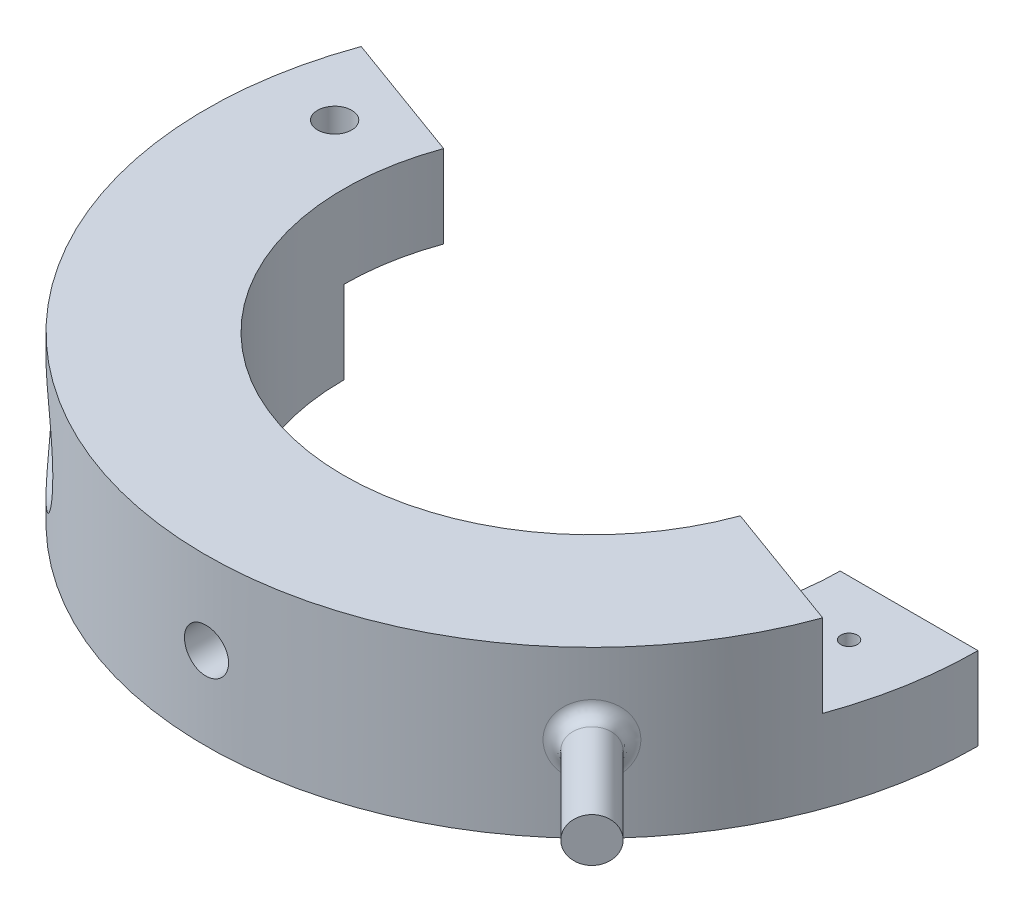
from build123d import *

# Parameters (mm, degrees)
BOSS_EXTRUDE1_DEPTH      = 30
BOSS_EXTRUDE2_START      = -15
BOSS_EXTRUDE2_DEPTH      = 15
CUT_EXTRUDE1_START       = -15
CUT_EXTRUDE1_DEPTH       = 15
SKETCH5_R                = 1.5
CUT_EXTRUDE2_DEPTH       = 15
SKETCH6_R                = 3.1
CUT_EXTRUDE4_DEPTH       = 5
SKETCH7_R                = 1.5
CUT_EXTRUDE5_DEPTH       = 15
SKETCH10_R               = 3.1
CUT_EXTRUDE6_DEPTH       = 5
SKETCH11_R               = 4
CUT_EXTRUDE8_DEPTH       = 30
BOSS_EXTRUDE3_DEPTH      = 22
BOSS_EXTRUDE3_DEPTH_BACK = 10
SKETCH13_R               = 4
SKETCH15_R               = 7.5
CUT_EXTRUDE9_DEPTH       = 30
SKETCH16_R               = 11
CUT_EXTRUDE10_DEPTH      = 20
FILLET2_R                = 2.5


with BuildPart() as part:
    # Sketch2 → Boss-Extrude1 (new body)
    with BuildSketch(Plane(origin=(0, 0, 0), x_dir=(1, 0, 0), z_dir=(0, 1, 0))):
        with BuildLine():
            Line((-70, 0), (-45, 0))
            ThreePointArc((-45, 0), (0, -45), (45, 0))
            Line((45, 0), (70, 0))
            ThreePointArc((70, 0), (0, -70), (-70, 0))
        make_face()
    extrude(amount=BOSS_EXTRUDE1_DEPTH)

    # Sketch3 → Boss-Extrude2 (add)
    with BuildSketch(Plane(origin=(0, 30, 0), x_dir=(1, 0, 0), z_dir=(0, 1, 0)).offset(BOSS_EXTRUDE2_START)):
        with BuildLine():
            Line((-65.778483455, 23.941410033), (-42.286167935, 15.39090645))
            ThreePointArc((-42.286167935, 15.39090645), (-44.316348886, 7.814167995), (-45, 0))
            Line((-45, 0), (-70, 0))
            ThreePointArc((-70, 0), (-68.936542711, 12.155372437), (-65.778483455, 23.941410033))
        make_face()
    extrude(amount=BOSS_EXTRUDE2_DEPTH)

    # Sketch4 → Cut-Extrude1 (cut)
    with BuildSketch(Plane(origin=(0, 30, 0), x_dir=(1, 0, 0), z_dir=(0, 1, 0)).offset(CUT_EXTRUDE1_START)):
        with BuildLine():
            Line((45, 0), (70, 0))
            ThreePointArc((70, 0), (68.936542711, -12.155372437), (65.778483455, -23.941410033))
            Line((65.778483455, -23.941410033), (42.286167935, -15.39090645))
            ThreePointArc((42.286167935, -15.39090645), (44.316348886, -7.814167995), (45, 0))
        make_face()
    extrude(amount=CUT_EXTRUDE1_DEPTH, mode=Mode.SUBTRACT)

    # Sketch5 → Cut-Extrude2 (cut)
    with BuildSketch(Plane(origin=(0, 15, 0), x_dir=(1, 0, 0), z_dir=(0, 1, 0))):
        with Locations(Location((56.623758265, -10, 0), (0, 0, 270))):
            Circle(SKETCH5_R)
    extrude(amount=-CUT_EXTRUDE2_DEPTH, mode=Mode.SUBTRACT)

    # Sketch6 → Cut-Extrude4 (cut)
    with BuildSketch(Plane.XZ):
        with Locations(Location((56.623758265, 10, 0), (0, 0, 270))):
            Circle(SKETCH6_R)
    extrude(amount=-CUT_EXTRUDE4_DEPTH, mode=Mode.SUBTRACT)

    # Sketch7 → Cut-Extrude5 (cut)
    with BuildSketch(Plane.XZ.offset(-15)):
        with Locations(Location((-56.629129236, -9.969539709, 0), (0, 0, 270))):
            Circle(SKETCH7_R)
    extrude(amount=-CUT_EXTRUDE5_DEPTH, mode=Mode.SUBTRACT)

    # Sketch10 → Cut-Extrude6 (cut)
    with BuildSketch(Plane(origin=(0, 30, 0), x_dir=(1, 0, 0), z_dir=(0, 1, 0))):
        with Locations(Location((-56.629129236, 9.969539709, 0), (0, 0, 270))):
            Circle(SKETCH10_R)
    extrude(amount=-CUT_EXTRUDE6_DEPTH, mode=Mode.SUBTRACT)

    # Sketch11 → Cut-Extrude8 (cut)
    with BuildSketch(Plane.XY.offset(70)):
        with Locations((0, 15)):
            Circle(SKETCH11_R)
    extrude(amount=-CUT_EXTRUDE8_DEPTH, mode=Mode.SUBTRACT)

    # Sketch13 → Boss-Extrude3 (add, two sides: drawn at the far end of the back side and taken through both)
    with BuildSketch(Plane(origin=(49.497474683, 0, 49.497474683), x_dir=(0, -1, 0), z_dir=(0.7071067811865488, 0, 0.7071067811865464)).offset(-BOSS_EXTRUDE3_DEPTH_BACK)):
        with Locations(Location((-15.302933019, 0, 0), (0, 0, 90))):
            Circle(SKETCH13_R)
    extrude(amount=BOSS_EXTRUDE3_DEPTH + BOSS_EXTRUDE3_DEPTH_BACK)

    # Sketch15 → Cut-Extrude9 (cut)
    with BuildSketch(Plane(origin=(-49.497474683, 0, 49.497474683), x_dir=(0, -1, 0), z_dir=(-0.7071067811865488, 0, 0.7071067811865464))):
        with Locations(Location((-15, 0, 0), (0, 0, 90))):
            Circle(SKETCH15_R)
    extrude(amount=-CUT_EXTRUDE9_DEPTH, mode=Mode.SUBTRACT)

    # Sketch16 → Cut-Extrude10 (cut)
    with BuildSketch(Plane(origin=(-49.497474683, 0, 49.497474683), x_dir=(0, -1, 0), z_dir=(-0.7071067811865488, 0, 0.7071067811865464))):
        with Locations(Location((-15, 0, 0), (0, 0, 90))):
            Circle(SKETCH16_R)
    extrude(amount=-CUT_EXTRUDE10_DEPTH, mode=Mode.SUBTRACT)

    # Fillet2
    fillet2_edges = [part.edges().sort_by_distance(p)[0] for p in [
        (46.588169284, 15.30293302, 52.245023526),
    ]]
    fillet(fillet2_edges, radius=FILLET2_R)


solid = part.part
